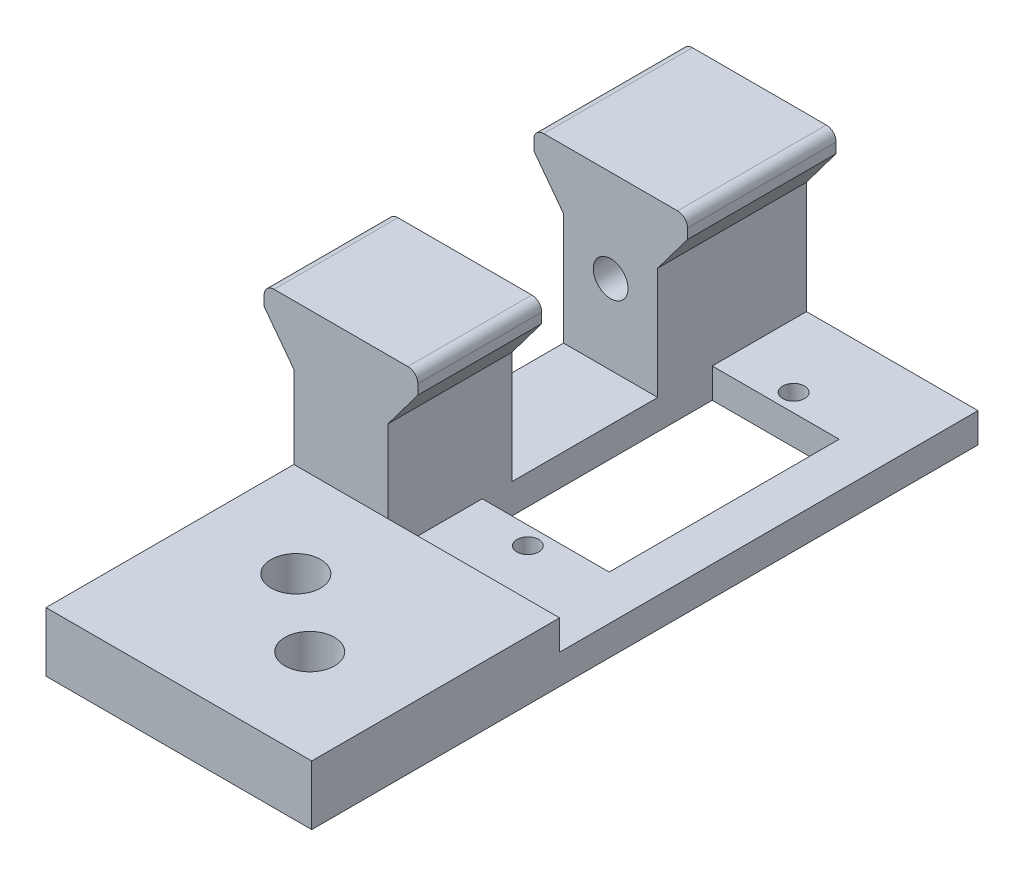
from build123d import *

# Parameters (mm, degrees)
SKETCH_5_W          = 26.8
SKETCH_5_H          = 42.2
SKETCH_5_R          = 1.1
SKETCH_5_W_2        = 12.8
SKETCH_5_H_2        = 23.2
EXTRUDE_1_DEPTH     = 3
SKETCH_7_W          = 9.5
SKETCH_7_H          = 15
SKETCH_7_H_2        = 12.5
EXTRUDE_2_DEPTH     = 17.3
SKETCH_10_R         = 1.75
CUT_EXTRUDE_2_DEPTH = 10
EXTRUDE_START       = -42.2
EXTRUDE_3_DEPTH     = 42.2
SKETCH_16_W         = 15.5
SKETCH_16_H         = 14.7
CUT_EXTRUDE_3_DEPTH = 17.3
FILLET_1_R          = 1
SKETCH_20_W         = 26.8
SKETCH_20_H         = 6
EXTRUDE_5_DEPTH     = 25
SKETCH_21_R         = 2.5
CUT_EXTRUDE_6_DEPTH = 4
SKETCH_22_R         = 1.1
CUT_EXTRUDE_7_DEPTH = 63.361606779


with BuildPart() as part:
    # 草图5 → 凸台-拉伸1 (new body)
    with BuildSketch(Plane(origin=(0, 0, 0), x_dir=(1, 0, 0), z_dir=(0, 1, 0))):
        with Locations((3.4, -11.1)):
            Rectangle(SKETCH_5_W, SKETCH_5_H)
        with Locations(Location((5.9, 2.3, 0), (0, 0, 270))):
            Circle(SKETCH_5_R, mode=Mode.SUBTRACT)
        with Locations(Location((5.9, -24.5, 0), (0, 0, 270))):
            Circle(SKETCH_5_R, mode=Mode.SUBTRACT)
        with Locations((5.9, -11.1)):
            Rectangle(SKETCH_5_W_2, SKETCH_5_H_2, mode=Mode.SUBTRACT)
    extrude(amount=EXTRUDE_1_DEPTH)

    # 草图7 → 凸台-拉伸2 (add)
    with BuildSketch(Plane(origin=(0, 3, 0), x_dir=(1, 0, 0), z_dir=(0, 1, 0))):
        with Locations((-5.25, 2.5)):
            Rectangle(SKETCH_7_W, SKETCH_7_H)
        with Locations((-5.25, -25.95)):
            Rectangle(SKETCH_7_W, SKETCH_7_H_2)
    extrude(amount=EXTRUDE_2_DEPTH)

    # 草图10 → 切除-拉伸2 (cut)
    with BuildSketch(Plane.XY.offset(5)):
        with Locations((-5.25, 11)):
            Circle(SKETCH_10_R)
    extrude(amount=-CUT_EXTRUDE_2_DEPTH, mode=Mode.SUBTRACT)

    # 草图13 → 凸台-拉伸3 (add)
    with BuildSketch(Plane.XY.offset(32.2).offset(EXTRUDE_START)):
        Polygon((-0.5, 20.3), (2.5, 20.3), (2.5, 18.3), (-0.5, 14.3), (-0.5, 15.553856002), align=None)
        Polygon((-10, 15.553856002), (-10, 14.3), (-13, 18.3), (-13, 20.3), (-10, 20.3), align=None)
    extrude(amount=EXTRUDE_3_DEPTH)

    # 草图16 → 切除-拉伸3 (cut)
    with BuildSketch(Plane(origin=(0, 20.3, 0), x_dir=(1, 0, 0), z_dir=(0, 1, 0))):
        with Locations((-5.25, -12.35)):
            Rectangle(SKETCH_16_W, SKETCH_16_H)
    extrude(amount=-CUT_EXTRUDE_3_DEPTH, mode=Mode.SUBTRACT)

    # 圆角1
    fillet_1_edges = [part.edges().sort_by_distance(p)[0] for p in [
        (-13, 20.3, 25.95),
        (2.5, 20.3, 25.95),
        (2.5, 20.3, -2.5),
        (-13, 20.3, -2.5),
    ]]
    fillet(fillet_1_edges, radius=FILLET_1_R)

    # 草图20 → 凸台-拉伸5 (add)
    with BuildSketch(Plane.XY.offset(32.2)):
        with Locations((3.4, 3)):
            Rectangle(SKETCH_20_W, SKETCH_20_H)
    extrude(amount=EXTRUDE_5_DEPTH)

    # 草图21 → 切除-拉伸6 (cut)
    with BuildSketch(Plane(origin=(0, 6, 0), x_dir=(1, 0, 0), z_dir=(0, 1, 0))):
        with Locations(Location((7.15, -47.75, 0), (0, 0, 270))):
            Circle(SKETCH_21_R)
        with Locations(Location((-0.35, -41.65, 0), (0, 0, 270))):
            Circle(SKETCH_21_R)
    extrude(amount=-CUT_EXTRUDE_6_DEPTH, mode=Mode.SUBTRACT)

    # 草图22 → 切除-拉伸7 (cut, through all)
    with BuildSketch(Plane(origin=(0, 2, 0), x_dir=(1, 0, 0), z_dir=(0, 1, 0))):
        with Locations(Location((-0.35, -41.65, 0), (0, 0, 270))):
            Circle(SKETCH_22_R)
        with Locations(Location((7.15, -47.75, 0), (0, 0, 270))):
            Circle(SKETCH_22_R)
    extrude(amount=-CUT_EXTRUDE_7_DEPTH, mode=Mode.SUBTRACT)


solid = part.part
